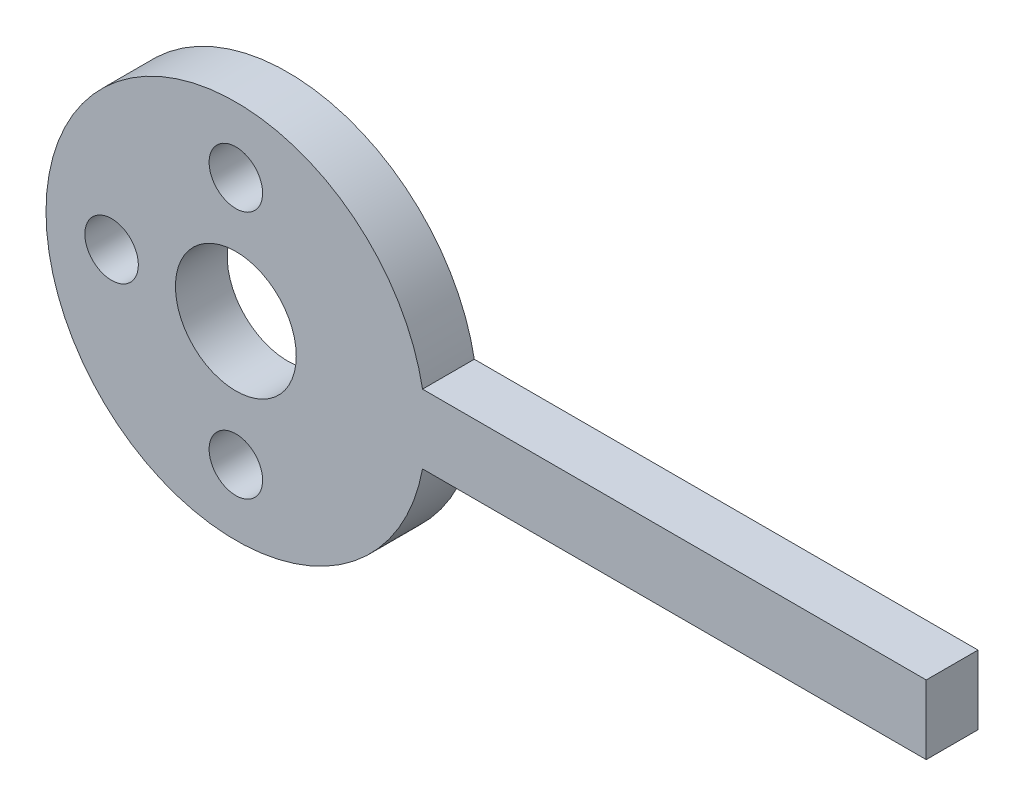
from build123d import *

# Parameters (mm, degrees)
ESBO_O1_R                = 3.5
ESBO_O1_R_2              = 1.55
RESSALTO_EXTRUS_O1_DEPTH = 3


with BuildPart() as part:
    # Esboço1 → Ressalto-extrusão1 (new body)
    with BuildSketch(Plane.XY):
        with BuildLine():
            Line((40, -2), (40, 2))
            Line((40, 2), (10.816653826, 2))
            ThreePointArc((10.816653826, 2), (-11, 0), (10.816653826, -2))
            Line((10.816653826, -2), (40, -2))
        make_face()
        Circle(ESBO_O1_R, mode=Mode.SUBTRACT)
        with Locations((0, 7.199999994)):
            Circle(ESBO_O1_R_2, mode=Mode.SUBTRACT)
        with Locations((-7.199999991, 0)):
            Circle(ESBO_O1_R_2, mode=Mode.SUBTRACT)
        with Locations((0, -7.199999987)):
            Circle(ESBO_O1_R_2, mode=Mode.SUBTRACT)
    extrude(amount=RESSALTO_EXTRUS_O1_DEPTH)


solid = part.part
